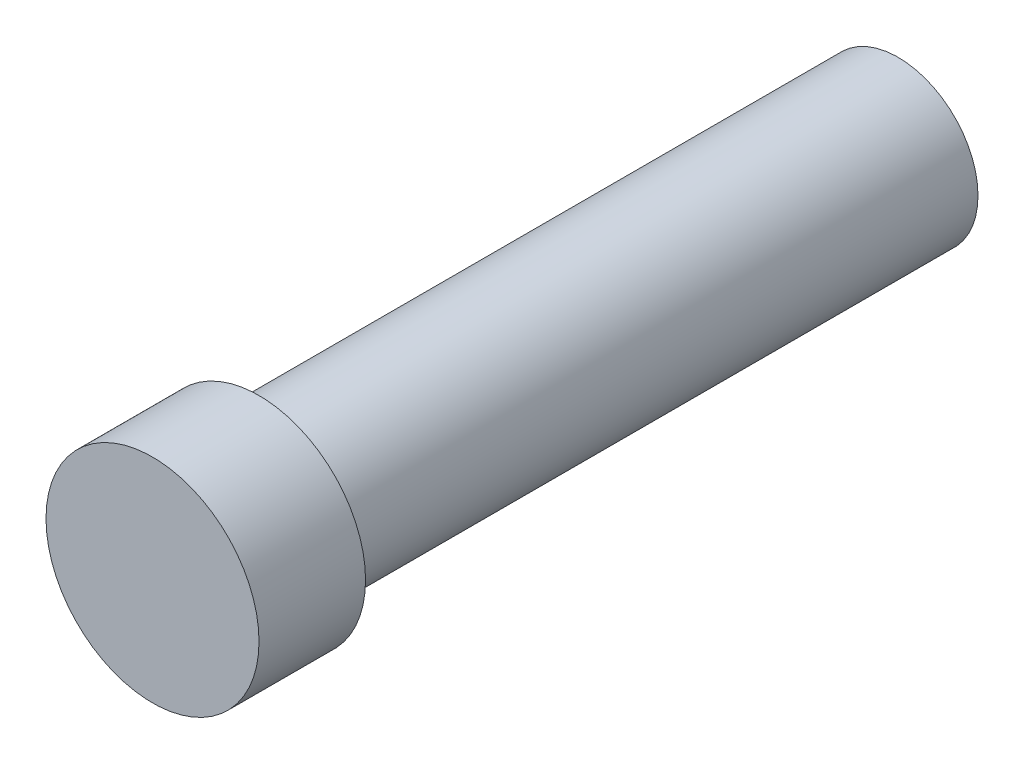
from build123d import *

# Parameters (mm, degrees)
CROQUIS1_R              = 1.5
SALIENTE_EXTRUIR1_DEPTH = 12
CROQUIS2_R              = 2
SALIENTE_EXTRUIR2_DEPTH = 2


with BuildPart() as part:
    # Croquis1 → Saliente-Extruir1 (new body)
    with BuildSketch(Plane.XY):
        Circle(CROQUIS1_R)
    extrude(amount=SALIENTE_EXTRUIR1_DEPTH)

    # Croquis2 → Saliente-Extruir2 (add)
    with BuildSketch(Plane.XY.offset(12)):
        Circle(CROQUIS2_R)
    extrude(amount=SALIENTE_EXTRUIR2_DEPTH)


solid = part.part
